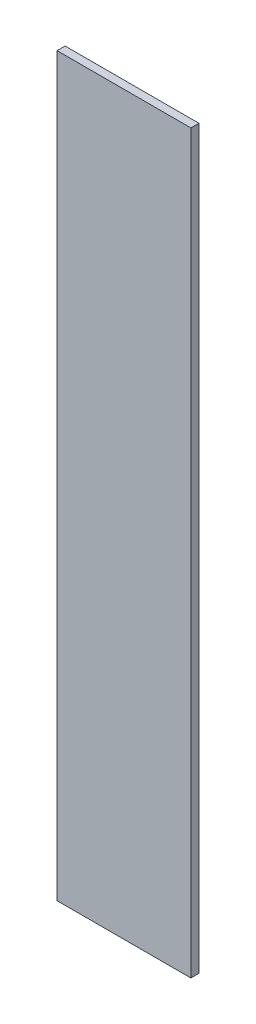
from build123d import *

# Parameters (mm, degrees)
ESQUISSE1_W        = 50
ESQUISSE1_H        = 275
BOSS_EXTRU_1_DEPTH = 3


with BuildPart() as part:
    # Esquisse1 → Boss.-Extru.1 (new body)
    with BuildSketch(Plane.XY):
        with Locations((2.19459655, -71.820809249)):
            Rectangle(ESQUISSE1_W, ESQUISSE1_H)
    extrude(amount=BOSS_EXTRU_1_DEPTH)


solid = part.part
